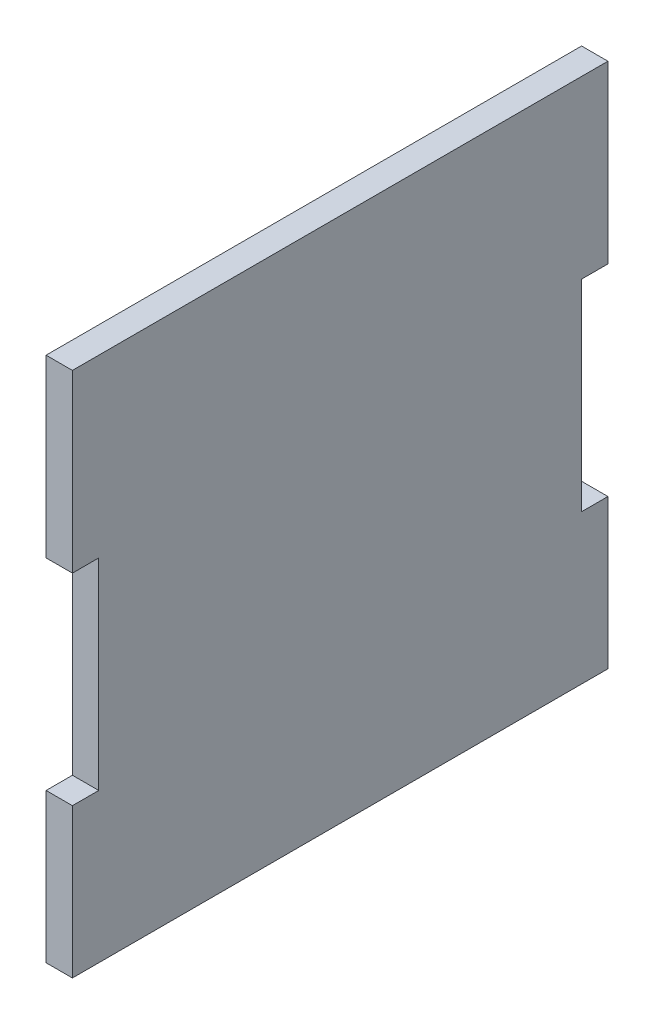
from build123d import *

# Parameters (mm, degrees)
BOSS_EXTRUDE1_DEPTH = 3


with BuildPart() as part:
    # Sketch1 → Boss-Extrude1 (new body)
    with BuildSketch(Plane(origin=(0, 0, 0), x_dir=(0, 0, -1), z_dir=(1, 0, 0))):
        Polygon((-27.5, 0), (27.5, 0), (30.5, 0), (30.5, 17), (27.5, 17), (27.5, 39.94), (30.5, 39.94), (30.5, 59.94), (27.5, 59.94), (-27.5, 59.94), (-30.5, 59.94), (-30.5, 39.94), (-27.5, 39.94), (-27.5, 17), (-30.5, 17), (-30.5, 0), align=None)
    extrude(amount=BOSS_EXTRUDE1_DEPTH)


solid = part.part
